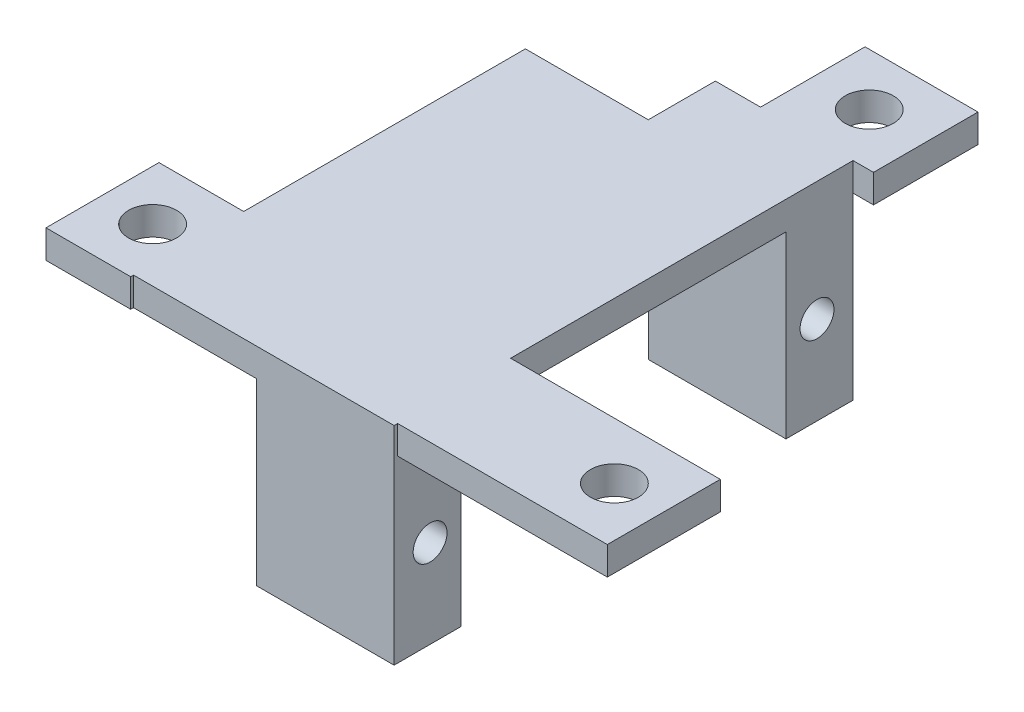
from build123d import *

# Parameters (mm, degrees)
BOSS_EXTRUDE1_DEPTH     = 2
SKETCH1_5_W             = 9.75
SKETCH1_5_H             = 4.75
BOSS_EXTRUDE2_DEPTH     = 12.7
CUT_EXTRUDE1_DEPTH      = 36.677198601
CUT_EXTRUDE1_DEPTH_BACK = 36.677198601
SKETCH1_6_R             = 1.7
CUT_EXTRUDE2_START      = 0.95
SKETCH2_R               = 1.2
CUT_EXTRUDE2_DEPTH      = 8


with BuildPart() as part:
    # Sketch1 → Boss-Extrude1 (new body)
    with BuildSketch(Plane(origin=(0, 0, 0), x_dir=(1, 0, 0), z_dir=(0, 1, 0))):
        Polygon((0.95, 16.25), (2.4, 16.25), (2.4, 23.65), (-5.6, 23.65), (-5.6, 16.25), (-8.8, 16.25), (-8.8, 11.5), (-17.5, 11.5), (-17.5, -8.45), (-23.5, -8.45), (-23.5, -16.45), (-17.5, -16.45), (-17.5, -16.25), (0.95, -16.25), (0.95, -16), (15.8, -16), (15.8, -8), (0.95, -8), align=None)
    extrude(amount=BOSS_EXTRUDE1_DEPTH)

    # Sketch1<5> → Boss-Extrude2 (add)
    with BuildSketch(Plane(origin=(0, 0, 0), x_dir=(1, 0, 0), z_dir=(0, 1, 0))):
        with Locations((-3.925, 13.875)):
            Rectangle(SKETCH1_5_W, SKETCH1_5_H)
        with Locations((-3.925, -13.875)):
            Rectangle(SKETCH1_5_W, SKETCH1_5_H)
    extrude(amount=-BOSS_EXTRUDE2_DEPTH)

    # Sketch1<6> → Cut-Extrude1 (cut, two sides: drawn at the far end of the back side and taken through both)
    with BuildSketch(Plane(origin=(0, 0, 0), x_dir=(1, 0, 0), z_dir=(0, 1, 0)).offset(-CUT_EXTRUDE1_DEPTH_BACK)):
        with Locations(Location((-1.6, 19.95, 0), (0, 0, 270))):
            Circle(SKETCH1_6_R)
        with Locations(Location((12.3, -12, 0), (0, 0, 270))):
            Circle(SKETCH1_6_R)
        with Locations(Location((-19.95, -12.45, 0), (0, 0, 270))):
            Circle(SKETCH1_6_R)
    extrude(amount=CUT_EXTRUDE1_DEPTH + CUT_EXTRUDE1_DEPTH_BACK, mode=Mode.SUBTRACT)

    # Sketch2 → Cut-Extrude2 (cut)
    with BuildSketch(Plane(origin=(0, 0, 0), x_dir=(0, 0, -1), z_dir=(1, 0, 0)).offset(CUT_EXTRUDE2_START)):
        with Locations(Location((-13.7, -6.45, 0), (0, 0, 180))):
            Circle(SKETCH2_R)
        with Locations(Location((13.7, -6.45, 0), (0, 0, 180))):
            Circle(SKETCH2_R)
    extrude(amount=-CUT_EXTRUDE2_DEPTH, mode=Mode.SUBTRACT)


solid = part.part
